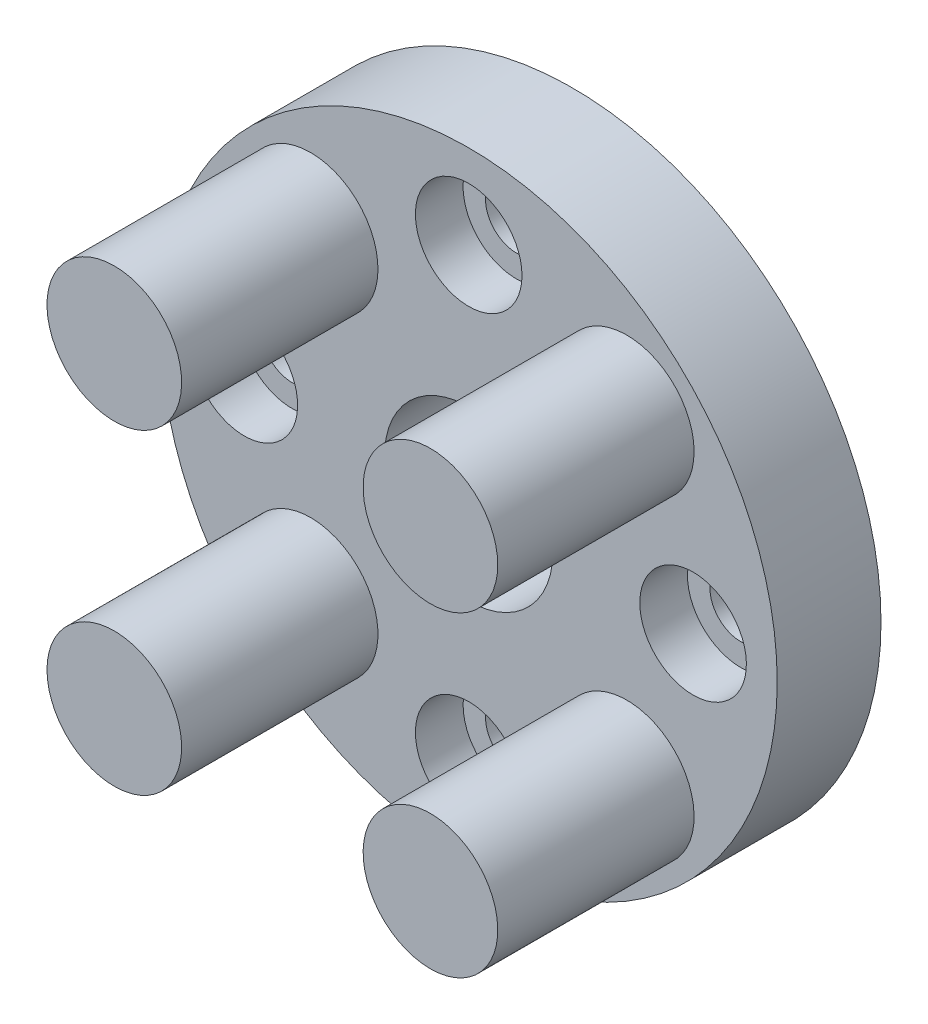
from build123d import *

# Parameters (mm, degrees)
DYNAMIXELHUB_R   = 11
DYNAMIXELHUB_R_2 = 3
DYNAMIXELHUB_R_3 = 1.1
HUB_DEPTH        = 3.7
SKETCH2_R        = 1.9
SCREWSLOT_DEPTH  = 1.7
SCREWSLOTS_COUNT = 4
SKETCH3_R        = 2.4
LEGOPIN_DEPTH    = 7
LEGOPINS_COUNT   = 4


with BuildPart() as part:
    # DynamixelHub → Hub (new body)
    with BuildSketch(Plane.XY):
        Circle(DYNAMIXELHUB_R)
        Circle(DYNAMIXELHUB_R_2, mode=Mode.SUBTRACT)
        with Locations((0, 8)):
            Circle(DYNAMIXELHUB_R_3, mode=Mode.SUBTRACT)
        with Locations((8, 0)):
            Circle(DYNAMIXELHUB_R_3, mode=Mode.SUBTRACT)
        with Locations((0, -8)):
            Circle(DYNAMIXELHUB_R_3, mode=Mode.SUBTRACT)
        with Locations((-8, 0)):
            Circle(DYNAMIXELHUB_R_3, mode=Mode.SUBTRACT)
    extrude(amount=HUB_DEPTH)

    # Sketch2 → ScrewSlot (cut)
    with BuildSketch(Plane.XY.offset(3.7)):
        with Locations((0, 8)):
            Circle(SKETCH2_R)
    screwslot = extrude(amount=-SCREWSLOT_DEPTH, mode=Mode.SUBTRACT)

    # ScrewSlots: ScrewSlot ×4 about axis
    screwslots_axis = Axis((0, 0, 0), (0, 0, 1))
    for i in range(1, SCREWSLOTS_COUNT):
        add(screwslot.rotate(screwslots_axis, i * 360 / SCREWSLOTS_COUNT), mode=Mode.SUBTRACT)

    # Sketch3 → LegoPin (add)
    with BuildSketch(Plane.XY.offset(3.7)):
        with Locations((5.635641046, 5.635641046)):
            Circle(SKETCH3_R)
    legopin = extrude(amount=LEGOPIN_DEPTH)

    # LegoPins: LegoPin ×4 about axis
    legopins_axis = Axis((0, 0, 0), (0, 0, 1))
    for i in range(1, LEGOPINS_COUNT):
        add(legopin.rotate(legopins_axis, i * 360 / LEGOPINS_COUNT))


solid = part.part
